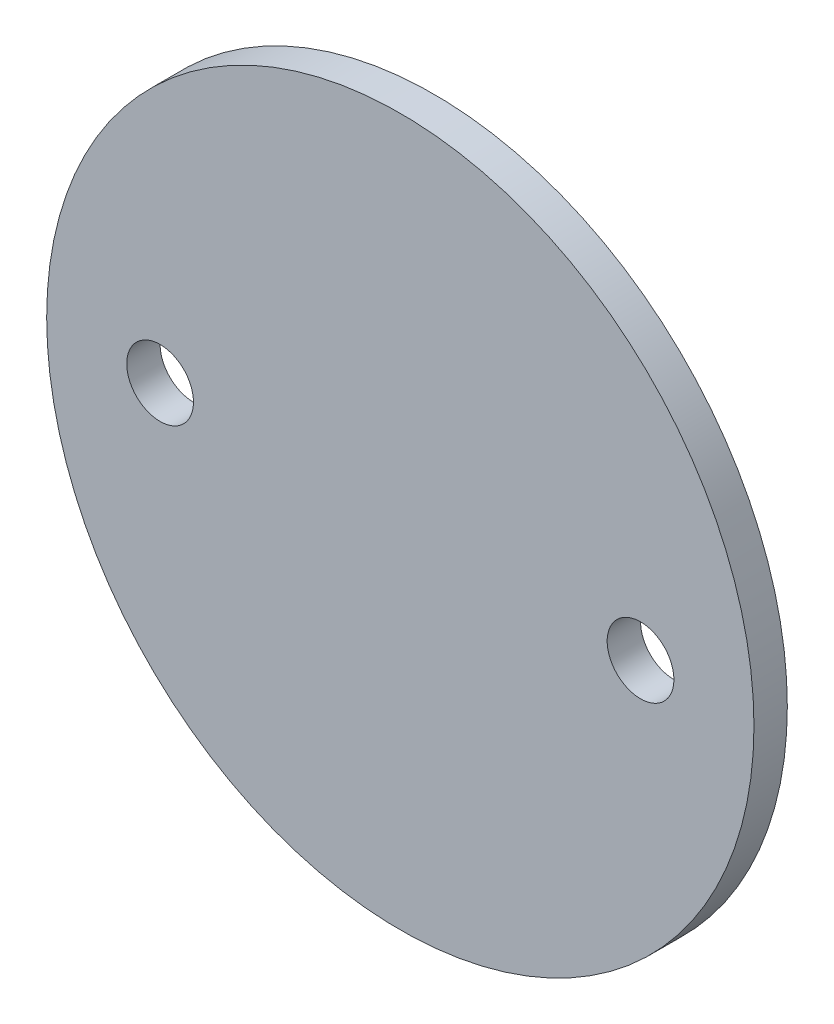
from build123d import *

# Parameters (mm, degrees)
SKETCH1_R           = 26.5
SKETCH1_R_2         = 2.5
BOSS_EXTRUDE1_DEPTH = 2.5


with BuildPart() as part:
    # Sketch1 → Boss-Extrude1 (new body)
    with BuildSketch(Plane.XY):
        Circle(SKETCH1_R)
        with Locations((18, 0)):
            Circle(SKETCH1_R_2, mode=Mode.SUBTRACT)
        with Locations((-18, 0)):
            Circle(SKETCH1_R_2, mode=Mode.SUBTRACT)
    extrude(amount=BOSS_EXTRUDE1_DEPTH)


solid = part.part
